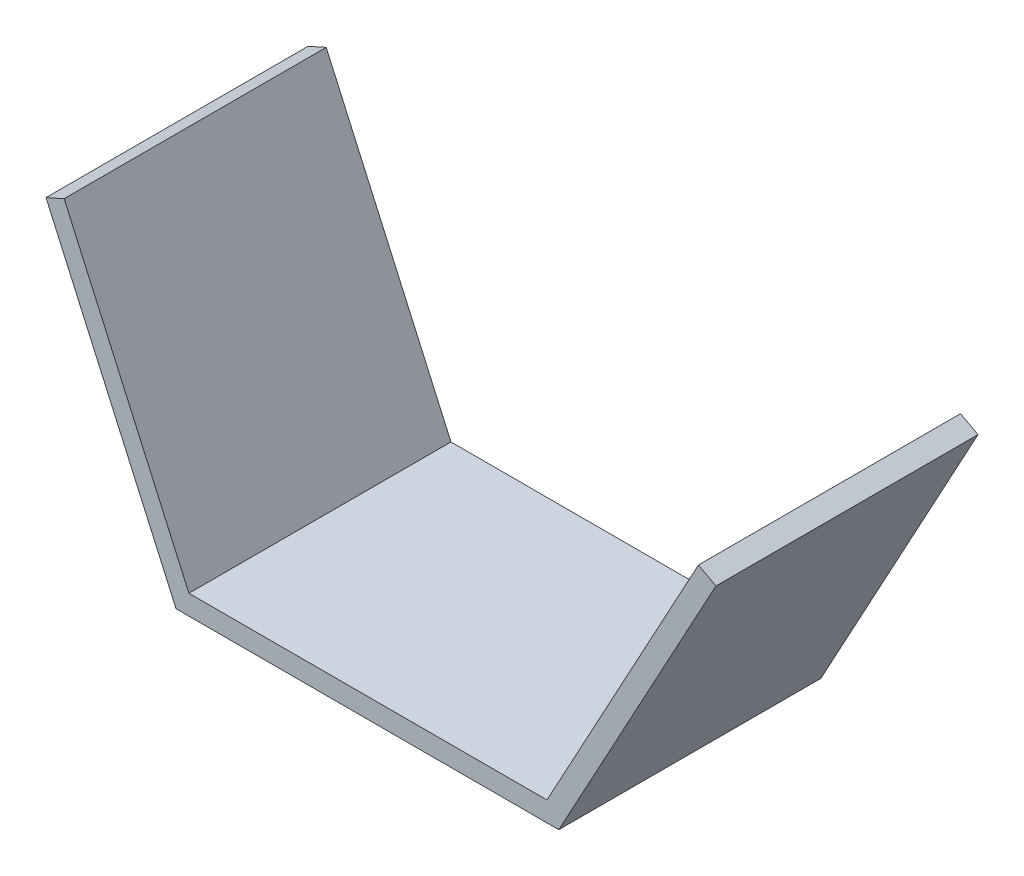
from build123d import *

# Parameters (mm, degrees)
EKSTR_ZYON_NCE1_DEPTH = 66


with BuildPart() as part:
    # Çizim1 → Ekstrüzyon-İnce1 (new body)
    with BuildSketch(Plane.XY):
        Polygon((-58.502445294, 23.386048527), (-27.071596074, -46.959185442), (63.105007045, -46.959185442), (101.271038241, 23.386048527), (105.665865377, 21.001621038), (66.080746967, -51.959185442), (-30.313952532, -51.959185442), (-63.067488848, 21.346348216), align=None)
    extrude(amount=EKSTR_ZYON_NCE1_DEPTH)


solid = part.part
